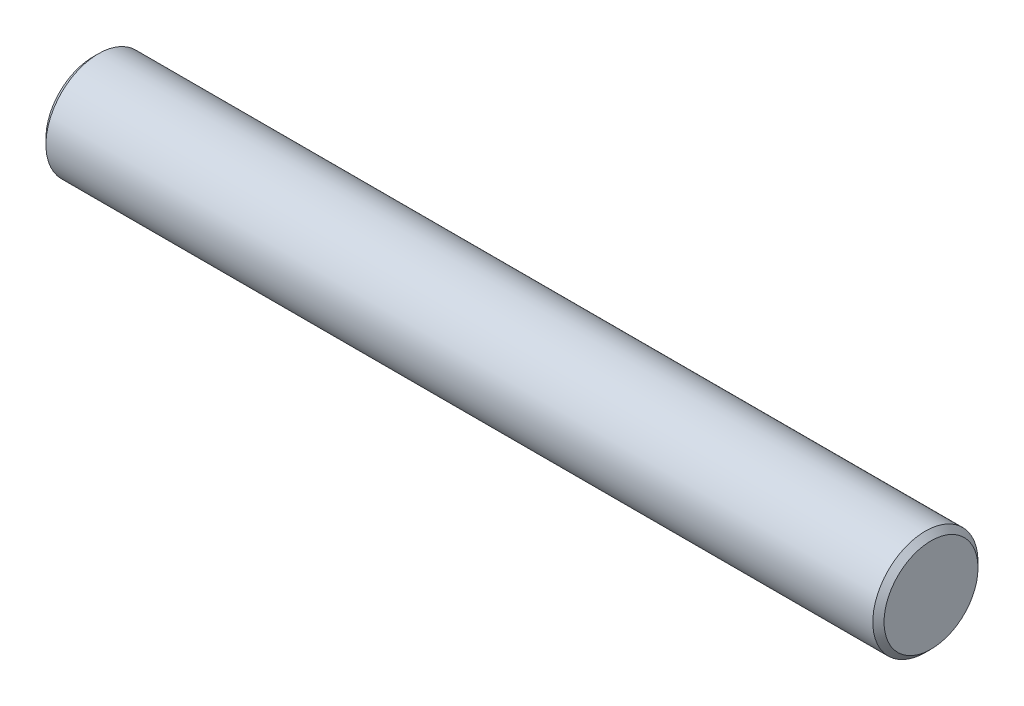
from build123d import *

# Parameters (mm, degrees)
SKETCH1_R      = 2.3749
EXTRUDE1_DEPTH = 37.846
CHAMFER1_SIZE  = 0.254


with BuildPart() as part:
    # Sketch1 → Extrude1 (new body)
    with BuildSketch(Plane(origin=(0, 0, 0), x_dir=(0, 0, -1), z_dir=(1, 0, 0))):
        Circle(SKETCH1_R)
    extrude(amount=EXTRUDE1_DEPTH)

    # Chamfer1
    chamfer1_edges = [part.edges().sort_by_distance(p)[0] for p in [
        (0, 0, 2.3749),
        (37.846, 0, 2.3749),
    ]]
    chamfer(chamfer1_edges, length=CHAMFER1_SIZE)


solid = part.part
